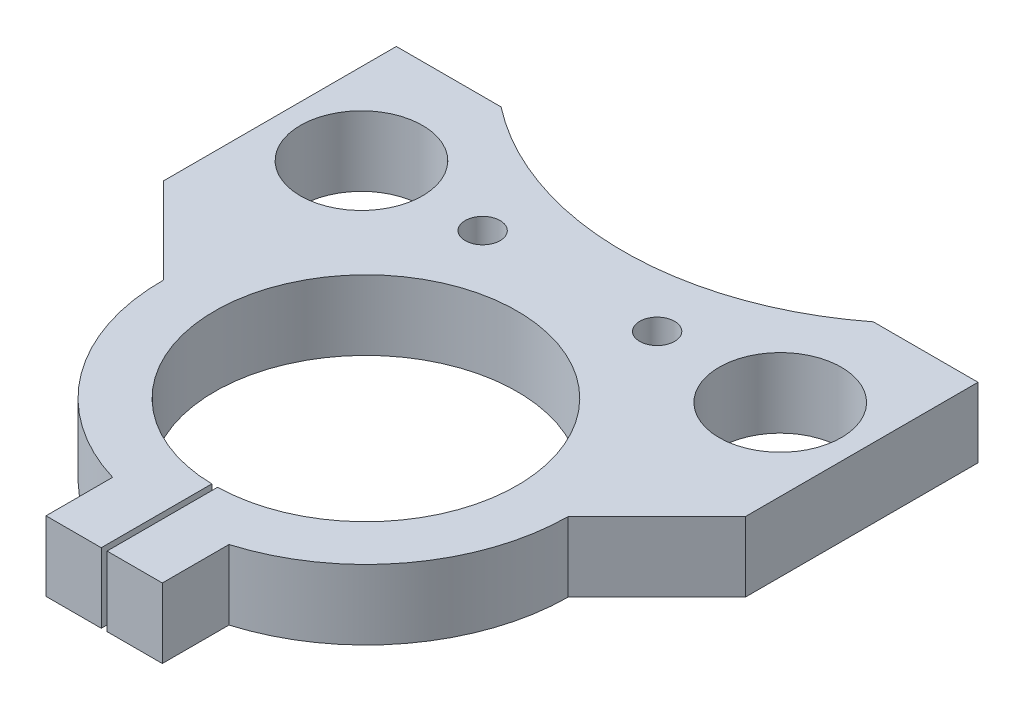
from build123d import *

# Parameters (mm, degrees)
SKETCH1_W           = 100
SKETCH1_H           = 100
SKETCH1_R           = 11
BOSS_EXTRUDE1_DEPTH = 12
SKETCH9_W           = 100
SKETCH9_H           = 50
BOSS_EXTRUDE3_DEPTH = 12
CUT_EXTRUDE3_REACH  = 114.446
SKETCH4_R           = 10.5
CUT_EXTRUDE4_REACH  = 114.446
CUT_EXTRUDE5_REACH  = 114.446
SKETCH6_R           = 26
CUT_EXTRUDE6_REACH  = 114.446
CUT_EXTRUDE7_REACH  = 114.446
SKETCH11_R          = 52.045454545
CUT_EXTRUDE8_REACH  = 114.446
SKETCH12_R          = 3


with BuildPart() as part:
    # Sketch1 → Boss-Extrude1 (new body)
    with BuildSketch(Plane(origin=(0, 0, 0), x_dir=(1, 0, 0), z_dir=(0, 1, 0))):
        Rectangle(SKETCH1_W, SKETCH1_H)
        with Locations(Location((0, 0, 0), (0, 0, 270))):
            Circle(SKETCH1_R, mode=Mode.SUBTRACT)
    extrude(amount=BOSS_EXTRUDE1_DEPTH)

    # Sketch9 → Boss-Extrude3 (add)
    with BuildSketch(Plane(origin=(0, 12, 0), x_dir=(1, 0, 0), z_dir=(0, 1, 0))):
        with Locations((0, -75)):
            Rectangle(SKETCH9_W, SKETCH9_H)
    extrude(amount=-BOSS_EXTRUDE3_DEPTH)

    # Sketch4 → Cut-Extrude3 (cut, up to next)
    with BuildSketch(Plane(origin=(0, 12, 0), x_dir=(1, 0, 0), z_dir=(0, 1, 0)), mode=Mode.PRIVATE) as cut_extrude3_sk1:
        with Locations(Location((-36, -20, 0), (0, 0, 270))):
            Circle(SKETCH4_R)
    cut_extrude3_tool1 = extrude(cut_extrude3_sk1.sketch, amount=-CUT_EXTRUDE3_REACH, mode=Mode.PRIVATE) & part.part
    # Sketch4 → Cut-Extrude3 (cut, up to next)
    with BuildSketch(Plane(origin=(0, 12, 0), x_dir=(1, 0, 0), z_dir=(0, 1, 0)), mode=Mode.PRIVATE) as cut_extrude3_sk2:
        with Locations(Location((36, -20, 0), (0, 0, 270))):
            Circle(SKETCH4_R)
    cut_extrude3_tool2 = extrude(cut_extrude3_sk2.sketch, amount=-CUT_EXTRUDE3_REACH, mode=Mode.PRIVATE) & part.part
    add(cut_extrude3_tool1.solids().sort_by_distance((-36, 12, 20))[0], mode=Mode.SUBTRACT)
    add(cut_extrude3_tool2.solids().sort_by_distance((36, 12, 20))[0], mode=Mode.SUBTRACT)

    # Sketch5 → Cut-Extrude4 (cut, up to next)
    with BuildSketch(Plane(origin=(0, 12, 0), x_dir=(1, 0, 0), z_dir=(0, 1, 0)), mode=Mode.PRIVATE) as cut_extrude4_sk1:
        Polygon((-50, 0), (-32, 0), (-32, 18), (32, 18), (32, 0), (50, 0), (50, 50), (-50, 50), align=None)
    cut_extrude4_tool1 = extrude(cut_extrude4_sk1.sketch, amount=-CUT_EXTRUDE4_REACH, mode=Mode.PRIVATE) & part.part
    add(cut_extrude4_tool1.solids().sort_by_distance((0, 12, -29.790021))[0], mode=Mode.SUBTRACT)

    # Sketch6 → Cut-Extrude5 (cut, up to next)
    with BuildSketch(Plane(origin=(0, 12, 0), x_dir=(1, 0, 0), z_dir=(0, 1, 0)), mode=Mode.PRIVATE) as cut_extrude5_sk1:
        with Locations(Location((-0.234960822, -55, 0), (0, 0, 270))):
            Circle(SKETCH6_R)
    cut_extrude5_tool1 = extrude(cut_extrude5_sk1.sketch, amount=-CUT_EXTRUDE5_REACH, mode=Mode.PRIVATE) & part.part
    add(cut_extrude5_tool1.solids().sort_by_distance((-0.234961, 12, 55))[0], mode=Mode.SUBTRACT)

    # Sketch10 → Cut-Extrude6 (cut, up to next)
    with BuildSketch(Plane(origin=(0, 12, 0), x_dir=(1, 0, 0), z_dir=(0, 1, 0)), mode=Mode.PRIVATE) as cut_extrude6_sk1:
        with BuildLine():
            Line((-10.234960822, -88.541019662), (-10.234960822, -100))
            Line((-10.234960822, -100), (-50, -100))
            Line((-50, -100), (-50, -40))
            Line((-50, -40), (-35.234177398, -54.765822602))
            ThreePointArc((-35.234177398, -54.765822602), (-28.367208461, -75.822503278), (-10.234960822, -88.541019662))
        make_face()
    cut_extrude6_tool1 = extrude(cut_extrude6_sk1.sketch, amount=-CUT_EXTRUDE6_REACH, mode=Mode.PRIVATE) & part.part
    # Sketch10 → Cut-Extrude6 (cut, up to next)
    with BuildSketch(Plane(origin=(0, 12, 0), x_dir=(1, 0, 0), z_dir=(0, 1, 0)), mode=Mode.PRIVATE) as cut_extrude6_sk2:
        with BuildLine():
            Line((9.765039178, -88.541019662), (9.765039178, -100))
            Line((9.765039178, -100), (50, -100))
            Line((50, -100), (50, -40))
            Line((50, -40), (34.764245164, -55.235754836))
            ThreePointArc((34.764245164, -55.235754836), (27.756864791, -76.010894766), (9.765039178, -88.541019662))
        make_face()
    cut_extrude6_tool2 = extrude(cut_extrude6_sk2.sketch, amount=-CUT_EXTRUDE6_REACH, mode=Mode.PRIVATE) & part.part
    # Sketch10 → Cut-Extrude6 (cut, up to next)
    with BuildSketch(Plane(origin=(0, 12, 0), x_dir=(1, 0, 0), z_dir=(0, 1, 0)), mode=Mode.PRIVATE) as cut_extrude6_sk3:
        with BuildLine():
            Line((-0.734960822, -80.995191863), (-0.734960822, -100))
            Line((-0.734960822, -100), (0.265039178, -100))
            Line((0.265039178, -100), (0.265039178, -80.995191863))
            ThreePointArc((0.265039178, -80.995191863), (-0.234960822, -81), (-0.734960822, -80.995191863))
        make_face()
    cut_extrude6_tool3 = extrude(cut_extrude6_sk3.sketch, amount=-CUT_EXTRUDE6_REACH, mode=Mode.PRIVATE) & part.part
    add(cut_extrude6_tool1.solids().sort_by_distance((-35.978986, 12, 79.410224))[0], mode=Mode.SUBTRACT)
    add(cut_extrude6_tool2.solids().sort_by_distance((35.780347, 12, 79.379296))[0], mode=Mode.SUBTRACT)
    add(cut_extrude6_tool3.solids().sort_by_distance((-0.234961, 12, 90.499199))[0], mode=Mode.SUBTRACT)

    # Sketch11 → Cut-Extrude7 (cut, up to next)
    with BuildSketch(Plane(origin=(0, 12, 0), x_dir=(1, 0, 0), z_dir=(0, 1, 0)), mode=Mode.PRIVATE) as cut_extrude7_sk1:
        with Locations((0, 41.045454545)):
            Circle(SKETCH11_R)
    cut_extrude7_tool1 = extrude(cut_extrude7_sk1.sketch, amount=-CUT_EXTRUDE7_REACH, mode=Mode.PRIVATE) & part.part
    add(cut_extrude7_tool1.solids().sort_by_distance((0, 12, -41.045455))[0], mode=Mode.SUBTRACT)

    # Sketch12 → Cut-Extrude8 (cut, up to next)
    with BuildSketch(Plane(origin=(0, 12, 0), x_dir=(1, 0, 0), z_dir=(0, 1, 0)), mode=Mode.PRIVATE) as cut_extrude8_sk1:
        with Locations(Location((-15.162534268, -20, 0), (0, 0, 270))):
            Circle(SKETCH12_R)
    cut_extrude8_tool1 = extrude(cut_extrude8_sk1.sketch, amount=-CUT_EXTRUDE8_REACH, mode=Mode.PRIVATE) & part.part
    # Sketch12 → Cut-Extrude8 (cut, up to next)
    with BuildSketch(Plane(origin=(0, 12, 0), x_dir=(1, 0, 0), z_dir=(0, 1, 0)), mode=Mode.PRIVATE) as cut_extrude8_sk2:
        with Locations(Location((14.837465732, -20, 0), (0, 0, 270))):
            Circle(SKETCH12_R)
    cut_extrude8_tool2 = extrude(cut_extrude8_sk2.sketch, amount=-CUT_EXTRUDE8_REACH, mode=Mode.PRIVATE) & part.part
    add(cut_extrude8_tool1.solids().sort_by_distance((-15.162534, 12, 20))[0], mode=Mode.SUBTRACT)
    add(cut_extrude8_tool2.solids().sort_by_distance((14.837466, 12, 20))[0], mode=Mode.SUBTRACT)


solid = part.part
